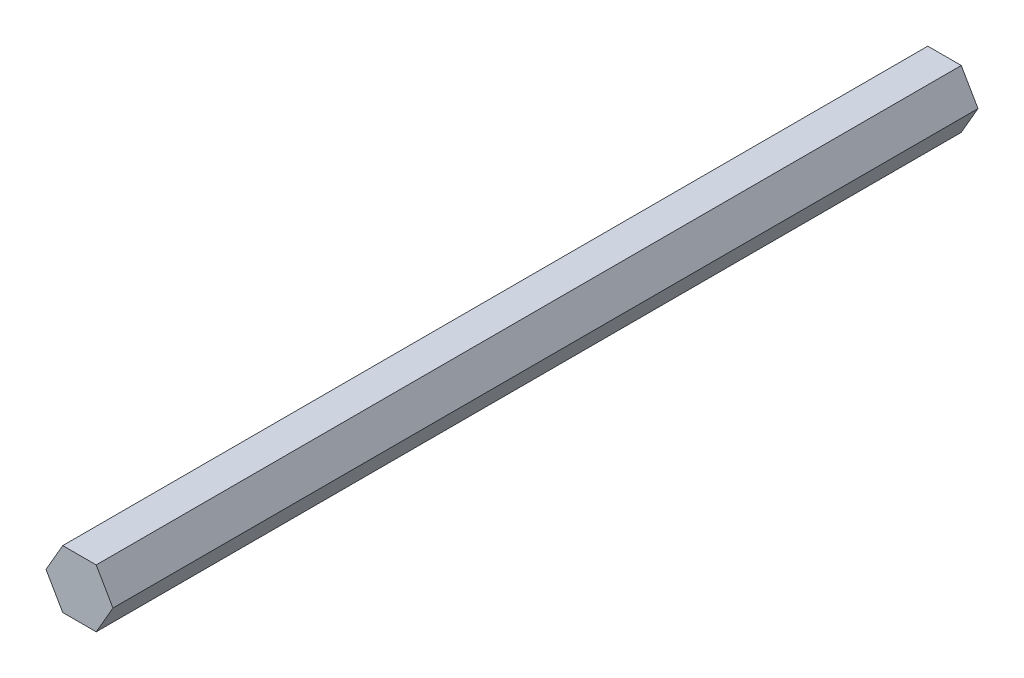
from build123d import *

# Parameters (mm, degrees)
SALIENTE_EXTRUIR1_DEPTH = 189.5


with BuildPart() as part:
    # Croquis1 → Saliente-Extruir1 (new body)
    with BuildSketch(Plane.XY):
        Polygon((7.332348419, 0), (3.666174209, 6.35), (-3.666174209, 6.35), (-7.332348419, 0), (-3.666174209, -6.35), (3.666174209, -6.35), align=None)
    extrude(amount=SALIENTE_EXTRUIR1_DEPTH)


solid = part.part
